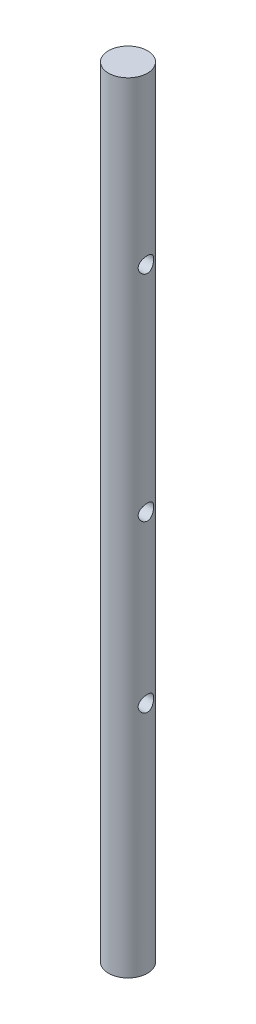
from build123d import *

# Parameters (mm, degrees)
SKETCH1_R           = 2
BOSS_EXTRUDE1_DEPTH = 40
SKETCH3_R           = 0.79375
CUT_EXTRUDE1_DEPTH  = 5
SKETCH4_R           = 0.79375
CUT_EXTRUDE2_DEPTH  = 5


with BuildPart() as part:
    # Sketch1 → Boss-Extrude1 (new, symmetric)
    with BuildSketch(Plane(origin=(0, 0, 0), x_dir=(1, 0, 0), z_dir=(0, 1, 0))):
        with Locations(Location((0, 0, 0), (0, 0, 270))):
            Circle(SKETCH1_R)
    extrude(amount=BOSS_EXTRUDE1_DEPTH, both=True)

    # Sketch3 → Cut-Extrude1 (cut, symmetric)
    with BuildSketch(Plane(origin=(0, 0, 0), x_dir=(0, 0, -1), z_dir=(1, 0, 0))):
        with Locations((0, 1)):
            Circle(SKETCH3_R)
        with Locations((0, 23)):
            Circle(SKETCH3_R)
    extrude(amount=CUT_EXTRUDE1_DEPTH, both=True, mode=Mode.SUBTRACT)

    # Sketch4 → Cut-Extrude2 (cut, symmetric)
    with BuildSketch(Plane(origin=(0, 0, 0), x_dir=(0, 0, -1), z_dir=(1, 0, 0))):
        with Locations((0, -16)):
            Circle(SKETCH4_R)
    extrude(amount=CUT_EXTRUDE2_DEPTH, both=True, mode=Mode.SUBTRACT)


solid = part.part
